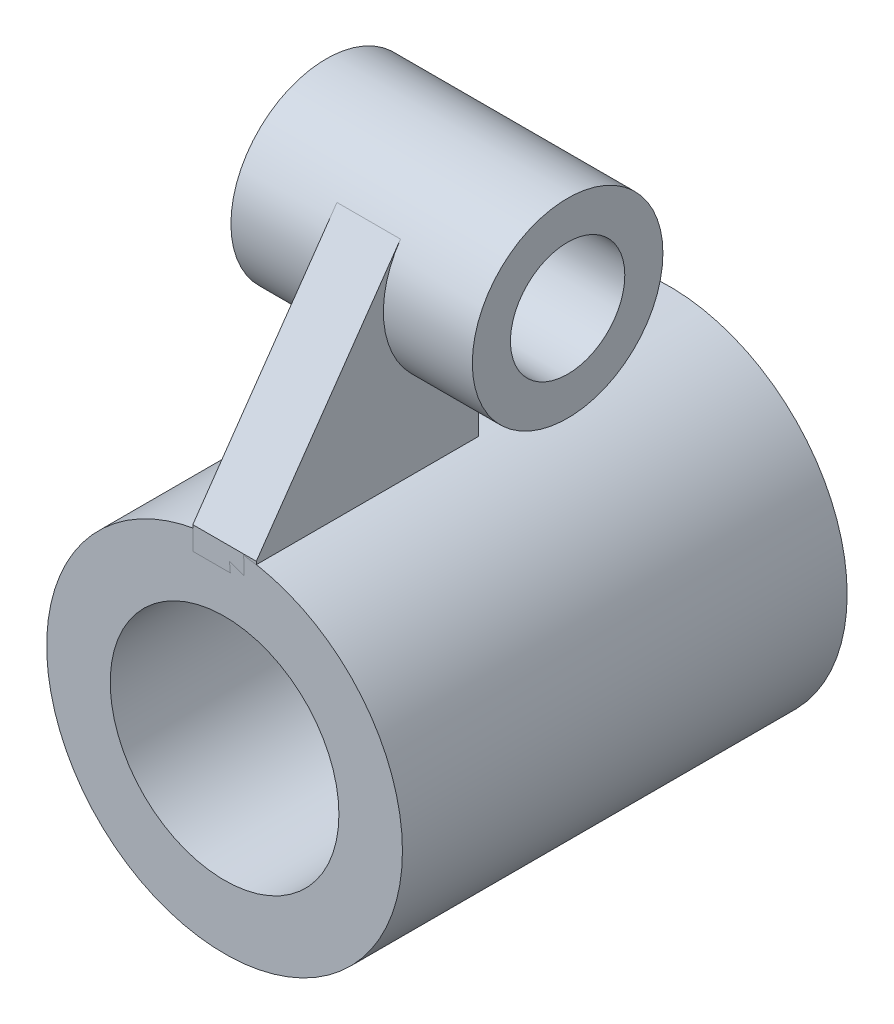
from build123d import *

# Parameters (mm, degrees)
SKETCH1_R           = 14
SKETCH1_R_2         = 9
EXTRUDE_THIN1_DEPTH = 17.5
SKETCH2_R           = 7.5
SKETCH2_R_2         = 4.5
EXTRUDE_THIN2_DEPTH = 9.5
BOSS_EXTRUDE1_DEPTH = 2.5


with BuildPart() as part:
    # Sketch1 → Extrude-Thin1 (new, symmetric)
    with BuildSketch(Plane.XY):
        Circle(SKETCH1_R)
        Circle(SKETCH1_R_2, mode=Mode.SUBTRACT)
    extrude(amount=EXTRUDE_THIN1_DEPTH, both=True)


with BuildPart() as body_2:
    # Sketch2 → Extrude-Thin2 (new, symmetric)
    with BuildSketch(Plane(origin=(0, 0, 0), x_dir=(0, 0, -1), z_dir=(1, 0, 0))):
        with Locations((0, 26)):
            Circle(SKETCH2_R)
        with Locations((0, 26)):
            Circle(SKETCH2_R_2, mode=Mode.SUBTRACT)
    extrude(amount=EXTRUDE_THIN2_DEPTH, both=True)

    # Sketch3 → Boss-Extrude1 (add, symmetric)
    with BuildSketch(Plane(origin=(0, 0, 0), x_dir=(0, 0, -1), z_dir=(1, 0, 0))):
        with BuildLine():
            Line((-17.5, 14), (-6.153967777, 30.287036342))
            ThreePointArc((-6.153967777, 30.287036342), (6.648412313, 29.471111309), (0, 18.5))
            Line((0, 18.5), (0, 14))
            Line((0, 14), (0, 12.183223564))
            Line((0, 12.183223564), (-17.5, 12.183223564))
            Line((-17.5, 12.183223564), (-17.5, 14))
        make_face()
    extrude(amount=BOSS_EXTRUDE1_DEPTH, both=True)


solid = Compound([part.part, body_2.part])
